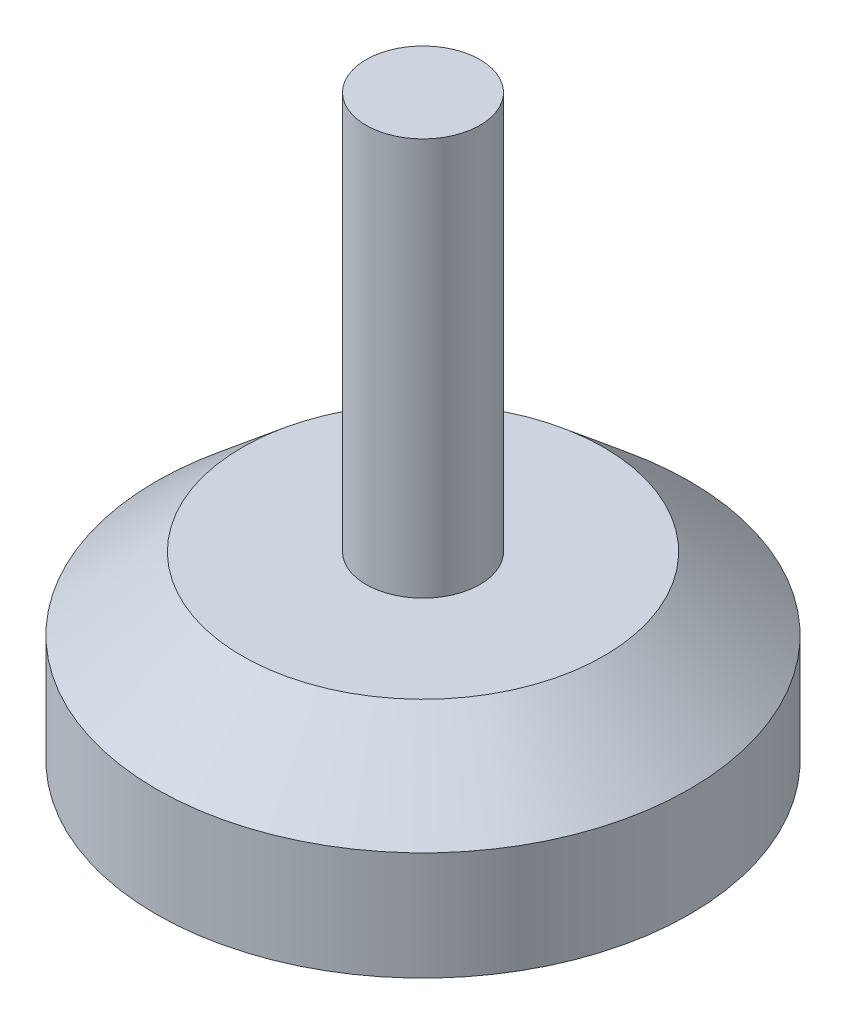
from build123d import *


with BuildPart() as part:
    # Esboço1 → Revolução1 (revolve)
    with BuildSketch(Plane.XY, mode=Mode.PRIVATE) as revolu_o1_sk:
        Polygon((0, 0), (0, 32), (-3.15, 32), (-3.15, 10), (-10, 10), (-14.75, 6), (-14.75, 0), align=None)
    revolve(revolu_o1_sk.sketch.rotate(Axis((0, 0, 0), (0, 1, 0)), 270), axis=Axis((0, 0, 0), (0, 1, 0)))


solid = part.part
